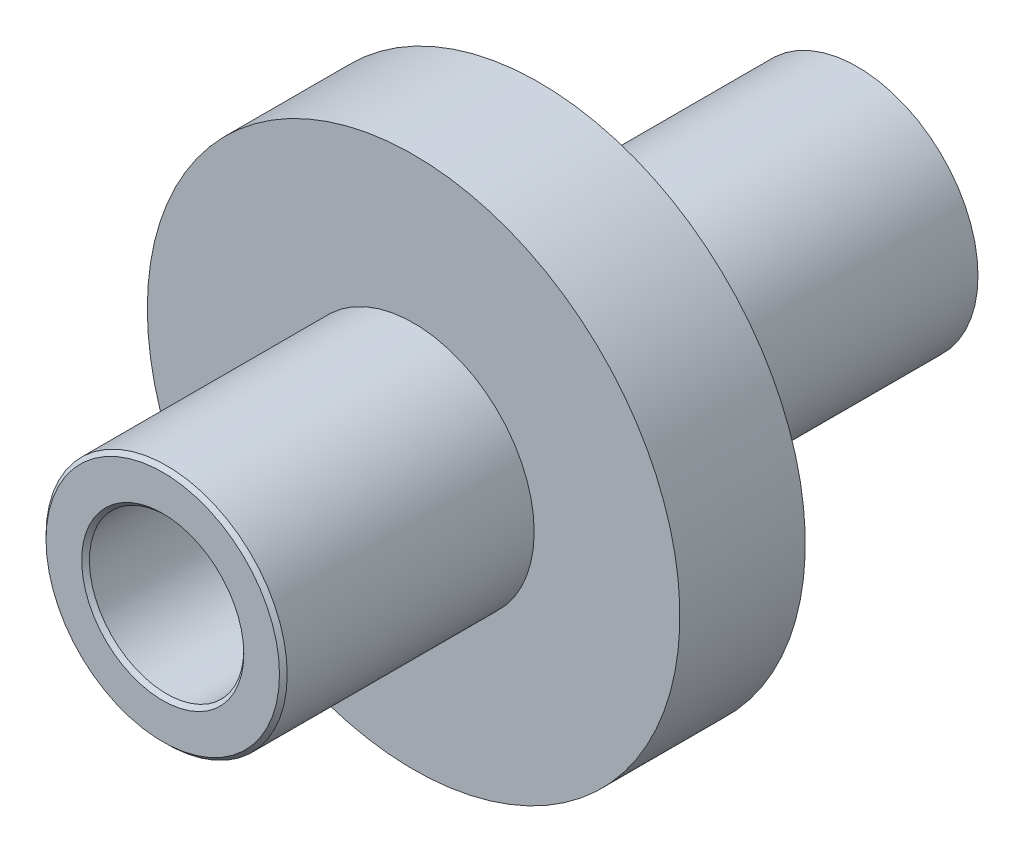
from build123d import *

# Parameters (mm, degrees)
SKETCH_1_R           = 13.8
SKETCH_1_R_2         = 4
EXTRUDE_1_DEPTH      = 6.5
EXTRUDE_2_DEPTH      = 13
EXTRUDE_2_DEPTH_BACK = 23
SKETCH_2_R           = 6.25
SKETCH_2_R_2         = 4
EXTRUDE_3_DEPTH      = 8
CHAMFER_1_SIZE       = 0.2


with BuildPart() as part:
    # Эскиз1 → Бобышка-Вытянуть1 (new body)
    with BuildSketch(Plane.XY):
        with Locations(Location((0, 0, 0), (0, 0, 180))):
            Circle(SKETCH_1_R)
        with Locations(Location((0, 0, 0), (0, 0, 180))):
            Circle(SKETCH_1_R_2, mode=Mode.SUBTRACT)
    extrude(amount=EXTRUDE_1_DEPTH)

    # Эскиз2 → Бобышка-Вытянуть2 (add, two sides: drawn at the far end of the back side and taken through both)
    with BuildSketch(Plane.XY.offset(6.5).offset(-EXTRUDE_2_DEPTH_BACK)):
        Circle(SKETCH_2_R)
        with Locations(Location((0, 0, 0), (0, 0, 180))):
            Circle(SKETCH_2_R_2, mode=Mode.SUBTRACT)
    extrude(amount=EXTRUDE_2_DEPTH + EXTRUDE_2_DEPTH_BACK)

    # Эскиз3 → Бобышка-Вытянуть3 (add)
    with BuildSketch(Plane(origin=(0, 0, -16.5), x_dir=(-1, 0, 0), z_dir=(0, 0, -1))):
        with BuildLine():
            Line((-3.464101615, -2), (3.464101615, -2))
            ThreePointArc((3.464101615, -2), (0, -4), (-3.464101615, -2))
        make_face()
    extrude(amount=-EXTRUDE_3_DEPTH)

    # Фаска1
    chamfer_1_edges = [part.edges().sort_by_distance(p)[0] for p in [
        (4, 0, 19.5),
        (-6.25, 0, 19.5),
        (1.03527618, 3.863703305, -16.5),
        (0, -2, -16.5),
    ]]
    chamfer(chamfer_1_edges, length=CHAMFER_1_SIZE)


solid = part.part
